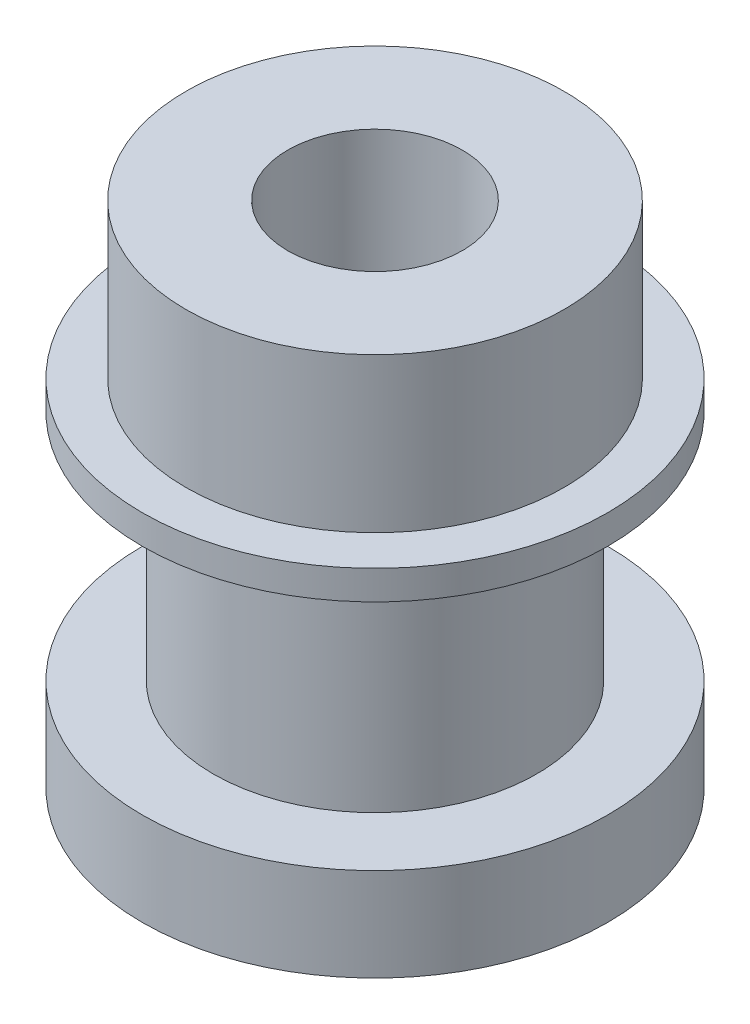
from build123d import *

# Parameters (mm, degrees)
SKETCH1_R               = 6.5
BOSS_EXTRUDE1_DEPTH     = 17.5
SKETCH2_R               = 8.62249149
SKETCH2_R_2             = 5.56
CUT_EXTRUDE1_DEPTH      = 8
CUT_EXTRUDE2_DEPTH      = 20.767397401
CUT_EXTRUDE2_DEPTH_BACK = 20.767397401
SKETCH4_R               = 3
SKETCH5_R               = 8
SKETCH5_R_2             = 3.869185068
BOSS_EXTRUDE2_DEPTH     = 1
SKETCH6_R               = 8
SKETCH6_R_2             = 3
BOSS_EXTRUDE3_DEPTH     = 3.2


with BuildPart() as part:
    # Sketch1 → Boss-Extrude1 (new body)
    with BuildSketch(Plane(origin=(0, 0, 0), x_dir=(1, 0, 0), z_dir=(0, 1, 0))):
        with Locations(Location((0, 0, 0), (0, 0, 270))):
            Circle(SKETCH1_R)
    extrude(amount=BOSS_EXTRUDE1_DEPTH)

    # Sketch2 → Cut-Extrude1 (cut)
    with BuildSketch(Plane(origin=(0, 11.2, 0), x_dir=(1, 0, 0), z_dir=(0, 1, 0))):
        Circle(SKETCH2_R)
        with Locations(Location((0, 0, 0), (0, 0, 270))):
            Circle(SKETCH2_R_2, mode=Mode.SUBTRACT)
    extrude(amount=-CUT_EXTRUDE1_DEPTH, mode=Mode.SUBTRACT)

    # Sketch4 → Cut-Extrude2 (cut, two sides: drawn at the far end of the back side and taken through both)
    with BuildSketch(Plane(origin=(0, 17.5, 0), x_dir=(1, 0, 0), z_dir=(0, 1, 0)).offset(-CUT_EXTRUDE2_DEPTH_BACK)):
        with Locations(Location((0, 0, 0), (0, 0, 270))):
            Circle(SKETCH4_R)
    extrude(amount=CUT_EXTRUDE2_DEPTH + CUT_EXTRUDE2_DEPTH_BACK, mode=Mode.SUBTRACT)

    # Sketch5 → Boss-Extrude2 (add)
    with BuildSketch(Plane(origin=(0, 11.2, 0), x_dir=(1, 0, 0), z_dir=(0, 1, 0))):
        with Locations(Location((0, 0, 0), (0, 0, 270))):
            Circle(SKETCH5_R)
        Circle(SKETCH5_R_2, mode=Mode.SUBTRACT)
    extrude(amount=BOSS_EXTRUDE2_DEPTH)

    # Sketch6 → Boss-Extrude3 (add)
    with BuildSketch(Plane(origin=(0, 0, 0), x_dir=(1, 0, 0), z_dir=(0, 1, 0))):
        with Locations(Location((0, 0, 0), (0, 0, 270))):
            Circle(SKETCH6_R)
        with Locations(Location((0, 0, 0), (0, 0, 270))):
            Circle(SKETCH6_R_2, mode=Mode.SUBTRACT)
    extrude(amount=BOSS_EXTRUDE3_DEPTH)


solid = part.part
